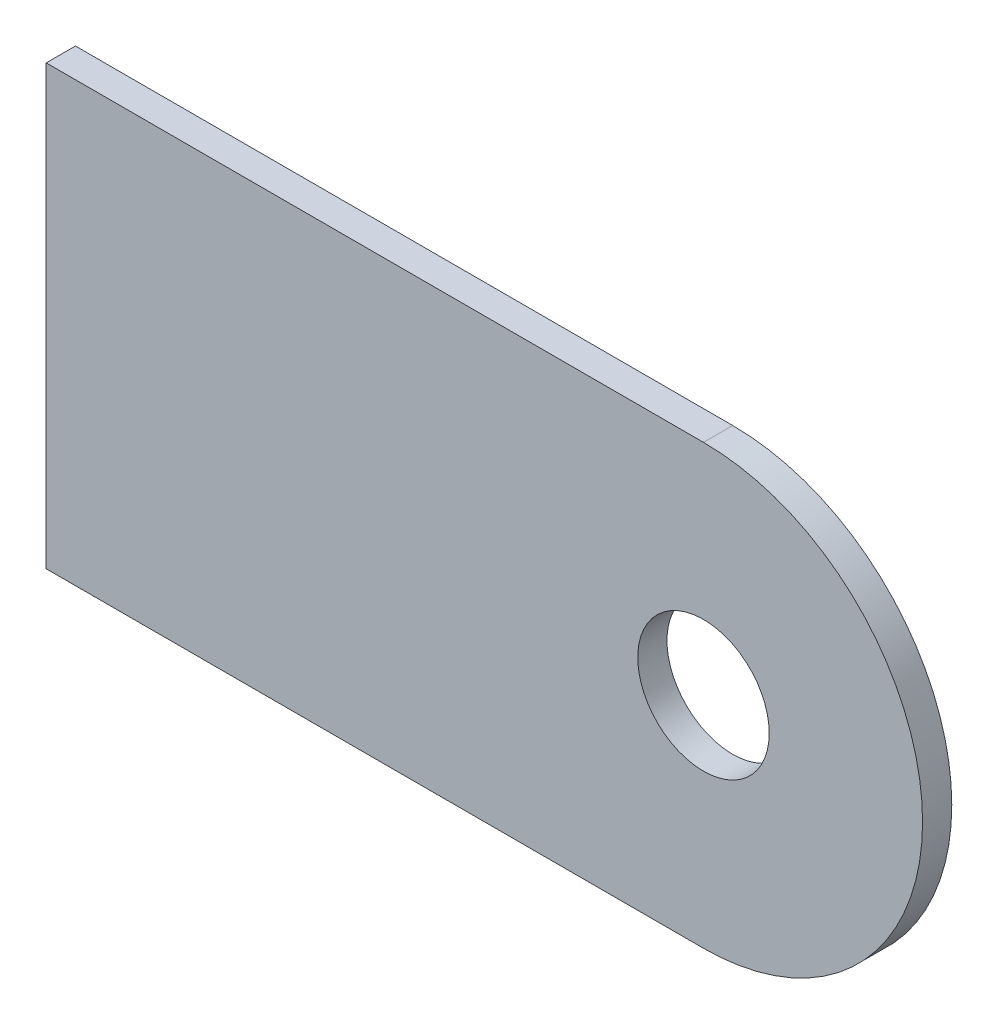
from build123d import *

# Parameters (mm, degrees)
SKETCH_1_R      = 9
EXTRUDE_1_DEPTH = 4


with BuildPart() as part:
    # 草图1 → 凸台-拉伸1 (new body)
    with BuildSketch(Plane.XY):
        with BuildLine():
            Line((0, 30), (-90, 30))
            Line((-90, 30), (-90, -30))
            Line((-90, -30), (0, -30))
            ThreePointArc((0, -30), (30, 0), (0, 30))
        make_face()
        Circle(SKETCH_1_R, mode=Mode.SUBTRACT)
    extrude(amount=EXTRUDE_1_DEPTH)


solid = part.part
